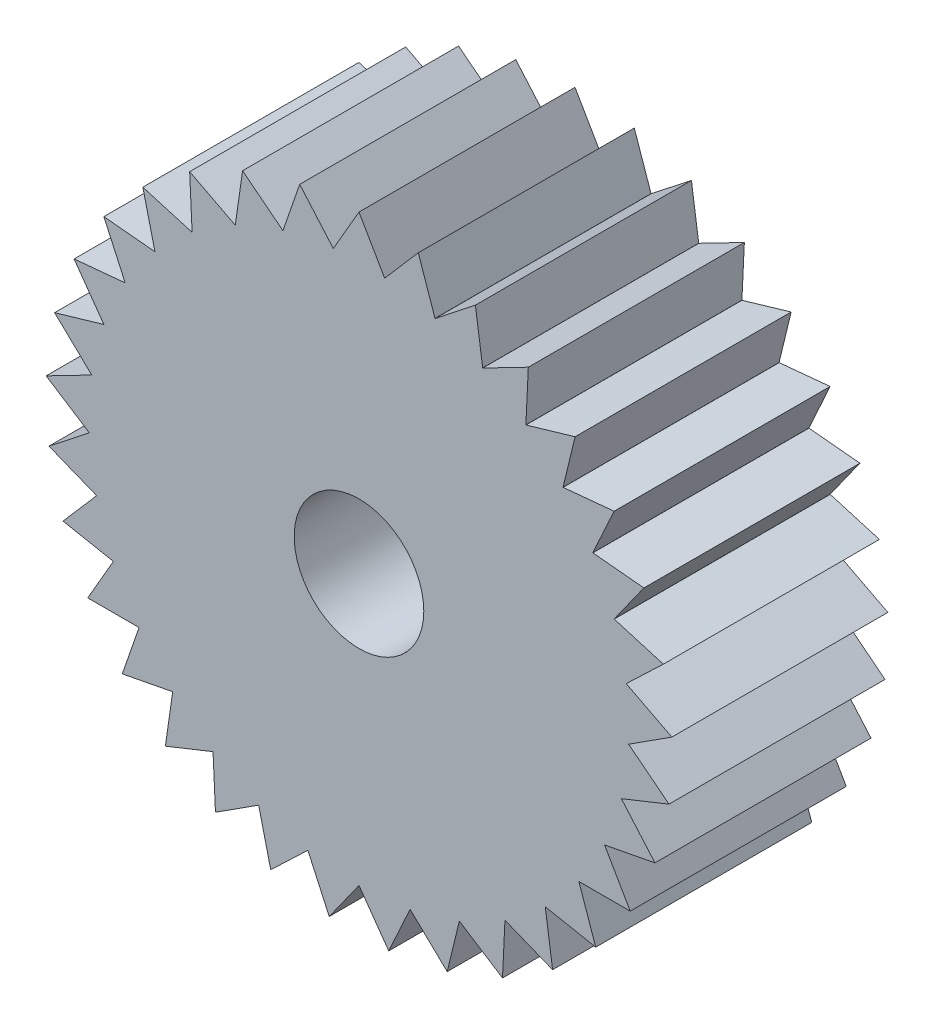
from build123d import *

# Parameters (mm, degrees)
SKETCH1_R           = 3
BOSS_EXTRUDE1_DEPTH = 10


with BuildPart() as part:
    # Sketch1 → Boss-Extrude1 (new body)
    with BuildSketch(Plane.XY):
        with BuildLine():
            Line((0, 14.498076211), (1.186155793, 12.443594112))
            ThreePointArc((1.186155793, 12.443594112), (1.188200541, 12.443399032), (1.190245258, 12.443203616))
            Line((1.190245258, 12.443203616), (2.743778964, 14.236077087))
            Line((2.743778964, 14.236077087), (3.519686083, 11.994240696))
            ThreePointArc((3.519686083, 11.994240696), (3.521656961, 11.99366217), (3.523627743, 11.99308332))
            Line((3.523627743, 11.99308332), (5.388390607, 13.459549045))
            Line((5.388390607, 13.459549045), (5.726005747, 11.111384171))
            ThreePointArc((5.726005747, 11.111384171), (5.727831522, 11.110443108), (5.729657142, 11.109501746))
            Line((5.729657142, 11.109501746), (7.838251774, 12.196557832))
            Line((7.838251774, 12.196557832), (7.725372644, 9.826933271))
            ThreePointArc((7.725372644, 9.826933271), (7.726987328, 9.825663684), (7.728601803, 9.824393833))
            Line((7.728601803, 9.824393833), (10.0048181, 10.492751241))
            Line((10.0048181, 10.492751241), (9.445524446, 8.187311399))
            ThreePointArc((9.445524446, 8.187311399), (9.446869679, 8.185759174), (9.448214658, 8.184206729))
            Line((9.448214658, 8.184206729), (11.809784233, 8.409709282))
            Line((11.809784233, 8.409709282), (10.824290385, 6.251778761))
            ThreePointArc((10.824290385, 6.251778761), (10.825317547, 6.25), (10.826344418, 6.248221071))
            Line((10.826344418, 6.248221071), (13.187913993, 6.022718518))
            Line((13.187913993, 6.022718518), (11.811838266, 4.090290549))
            ThreePointArc((11.811838266, 4.090290549), (11.812510234, 4.088349541), (11.813181883, 4.086408423))
            Line((11.813181883, 4.086408423), (14.089398181, 3.418051015))
            Line((14.089398181, 3.418051015), (12.372475537, 1.780968581))
            ThreePointArc((12.372475537, 1.780968581), (12.372768024, 1.778935478), (12.373060176, 1.776902328))
            Line((12.373060176, 1.776902328), (14.481654809, 0.689846242))
            Line((14.481654809, 0.689846242), (12.485939306, -0.592722233))
            ThreePointArc((12.485939306, -0.592722233), (12.48584174, -0.594773948), (12.485743836, -0.596825646))
            Line((12.485743836, -0.596825646), (14.3505067, -2.063291371))
            Line((14.3505067, -2.063291371), (12.148128697, -2.944990521))
            ThreePointArc((12.148128697, -2.944990521), (12.147644604, -2.946986694), (12.147160183, -2.948982787))
            Line((12.147160183, -2.948982787), (13.70069389, -4.741856258))
            Line((13.70069389, -4.741856258), (11.371253065, -5.190819178))
            ThreePointArc((11.371253065, -5.190819178), (11.370399942, -5.192687663), (11.369546512, -5.194556007))
            Line((11.369546512, -5.194556007), (12.555702305, -7.249038106))
            Line((12.555702305, -7.249038106), (10.183390719, -7.249038106))
            ThreePointArc((10.183390719, -7.249038106), (10.182199401, -7.25071137), (10.181007807, -7.252384438))
            Line((10.181007807, -7.252384438), (10.956914926, -9.494220829))
            Line((10.956914926, -9.494220829), (8.627474101, -9.045257909))
            ThreePointArc((8.627474101, -9.045257909), (8.625987644, -9.046675476), (8.624500953, -9.048092799))
            Line((8.624500953, -9.048092799), (8.962116093, -11.396257674))
            Line((8.962116093, -11.396257674), (6.75973809, -10.514558524))
            ThreePointArc((6.75973809, -10.514558524), (6.758010218, -10.51566916), (6.756282164, -10.516779513))
            Line((6.756282164, -10.516779513), (6.643403034, -12.886404074))
            Line((6.643403034, -12.886404074), (4.647687532, -11.603835599))
            ThreePointArc((4.647687532, -11.603835599), (4.645780696, -11.604599163), (4.643873734, -11.605362413))
            Line((4.643873734, -11.605362413), (4.08458008, -13.910802256))
            Line((4.08458008, -13.910802256), (2.367657437, -12.273719822))
            ThreePointArc((2.367657437, -12.273719822), (2.365640555, -12.274108716), (2.363623608, -12.274497278))
            Line((2.363623608, -12.274497278), (1.37812976, -14.4324278))
            Line((1.37812976, -14.4324278), (0.002054033, -12.499999831))
            ThreePointArc((0.002054033, -12.499999831), (0, -12.5), (-0.002054033, -12.499999831))
            Line((-0.002054033, -12.499999831), (-1.37812976, -14.4324278))
            Line((-1.37812976, -14.4324278), (-2.363623608, -12.274497278))
            ThreePointArc((-2.363623608, -12.274497278), (-2.365640555, -12.274108716), (-2.367657437, -12.273719822))
            Line((-2.367657437, -12.273719822), (-4.08458008, -13.910802256))
            Line((-4.08458008, -13.910802256), (-4.643873734, -11.605362413))
            ThreePointArc((-4.643873734, -11.605362413), (-4.645780696, -11.604599163), (-4.647687532, -11.603835599))
            Line((-4.647687532, -11.603835599), (-6.643403034, -12.886404074))
            Line((-6.643403034, -12.886404074), (-6.756282164, -10.516779513))
            ThreePointArc((-6.756282164, -10.516779513), (-6.758010218, -10.51566916), (-6.75973809, -10.514558524))
            Line((-6.75973809, -10.514558524), (-8.962116093, -11.396257674))
            Line((-8.962116093, -11.396257674), (-8.624500953, -9.048092799))
            ThreePointArc((-8.624500953, -9.048092799), (-8.625987644, -9.046675476), (-8.627474101, -9.045257909))
            Line((-8.627474101, -9.045257909), (-10.956914926, -9.494220829))
            Line((-10.956914926, -9.494220829), (-10.181007807, -7.252384438))
            ThreePointArc((-10.181007807, -7.252384438), (-10.182199401, -7.25071137), (-10.183390719, -7.249038106))
            Line((-10.183390719, -7.249038106), (-12.555702305, -7.249038106))
            Line((-12.555702305, -7.249038106), (-11.369546512, -5.194556007))
            ThreePointArc((-11.369546512, -5.194556007), (-11.370399942, -5.192687663), (-11.371253065, -5.190819178))
            Line((-11.371253065, -5.190819178), (-13.70069389, -4.741856258))
            Line((-13.70069389, -4.741856258), (-12.147160183, -2.948982787))
            ThreePointArc((-12.147160183, -2.948982787), (-12.147644604, -2.946986694), (-12.148128697, -2.944990521))
            Line((-12.148128697, -2.944990521), (-14.3505067, -2.063291371))
            Line((-14.3505067, -2.063291371), (-12.485743836, -0.596825646))
            ThreePointArc((-12.485743836, -0.596825646), (-12.48584174, -0.594773948), (-12.485939306, -0.592722233))
            Line((-12.485939306, -0.592722233), (-14.481654809, 0.689846242))
            Line((-14.481654809, 0.689846242), (-12.373060176, 1.776902328))
            ThreePointArc((-12.373060176, 1.776902328), (-12.372768024, 1.778935478), (-12.372475537, 1.780968581))
            Line((-12.372475537, 1.780968581), (-14.089398181, 3.418051015))
            Line((-14.089398181, 3.418051015), (-11.813181883, 4.086408423))
            ThreePointArc((-11.813181883, 4.086408423), (-11.812510234, 4.088349541), (-11.811838266, 4.090290549))
            Line((-11.811838266, 4.090290549), (-13.187913993, 6.022718518))
            Line((-13.187913993, 6.022718518), (-10.826344418, 6.248221071))
            ThreePointArc((-10.826344418, 6.248221071), (-10.825317547, 6.25), (-10.824290385, 6.251778761))
            Line((-10.824290385, 6.251778761), (-11.809784233, 8.409709282))
            Line((-11.809784233, 8.409709282), (-9.448214658, 8.184206729))
            ThreePointArc((-9.448214658, 8.184206729), (-9.446869679, 8.185759174), (-9.445524446, 8.187311399))
            Line((-9.445524446, 8.187311399), (-10.0048181, 10.492751241))
            Line((-10.0048181, 10.492751241), (-7.728601803, 9.824393833))
            ThreePointArc((-7.728601803, 9.824393833), (-7.726987328, 9.825663684), (-7.725372644, 9.826933271))
            Line((-7.725372644, 9.826933271), (-7.838251774, 12.196557832))
            Line((-7.838251774, 12.196557832), (-5.729657142, 11.109501746))
            ThreePointArc((-5.729657142, 11.109501746), (-5.727831522, 11.110443108), (-5.726005747, 11.111384171))
            Line((-5.726005747, 11.111384171), (-5.388390607, 13.459549045))
            Line((-5.388390607, 13.459549045), (-3.523627743, 11.99308332))
            ThreePointArc((-3.523627743, 11.99308332), (-3.521656961, 11.99366217), (-3.519686083, 11.994240696))
            Line((-3.519686083, 11.994240696), (-2.743778964, 14.236077087))
            Line((-2.743778964, 14.236077087), (-1.190245258, 12.443203616))
            ThreePointArc((-1.190245258, 12.443203616), (-1.188200541, 12.443399032), (-1.186155793, 12.443594112))
            Line((-1.186155793, 12.443594112), (0, 14.498076211))
        make_face()
        Circle(SKETCH1_R, mode=Mode.SUBTRACT)
    extrude(amount=BOSS_EXTRUDE1_DEPTH)


solid = part.part
